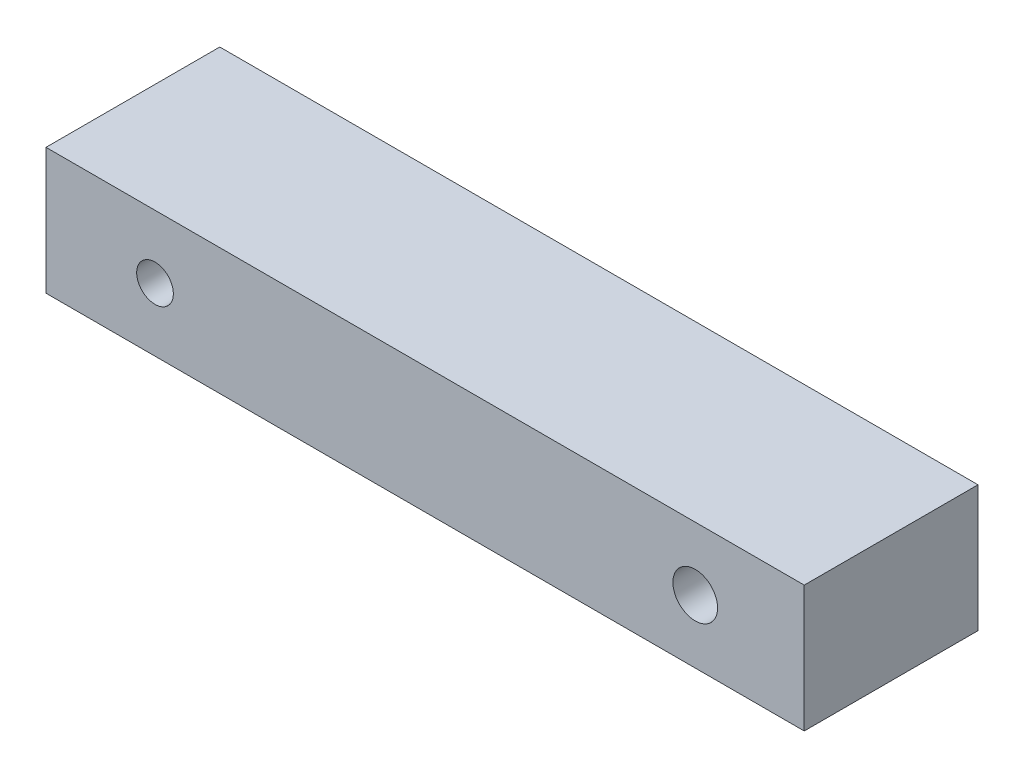
from build123d import *

# Parameters (mm, degrees)
SKETCH1_W           = 34.925
SKETCH1_H           = 25.4
BOSS_EXTRUDE1_DEPTH = 76.2
SKETCH2_R           = 3.687507865
SKETCH2_R_2         = 4.491133618
CUT_EXTRUDE1_DEPTH  = 85.77904001


with BuildPart() as part:
    # Sketch1 → Boss-Extrude1 (new, symmetric)
    with BuildSketch(Plane(origin=(0, 0, 0), x_dir=(0, 0, -1), z_dir=(1, 0, 0))):
        Rectangle(SKETCH1_W, SKETCH1_H)
    extrude(amount=BOSS_EXTRUDE1_DEPTH, both=True)

    # Sketch2 → Cut-Extrude1 (cut, through all)
    with BuildSketch(Plane.XY.offset(17.4625)):
        with Locations((-54.290984638, 0)):
            Circle(SKETCH2_R)
        with Locations((54.290984638, 0)):
            Circle(SKETCH2_R_2)
    extrude(amount=-CUT_EXTRUDE1_DEPTH, mode=Mode.SUBTRACT)


solid = part.part
